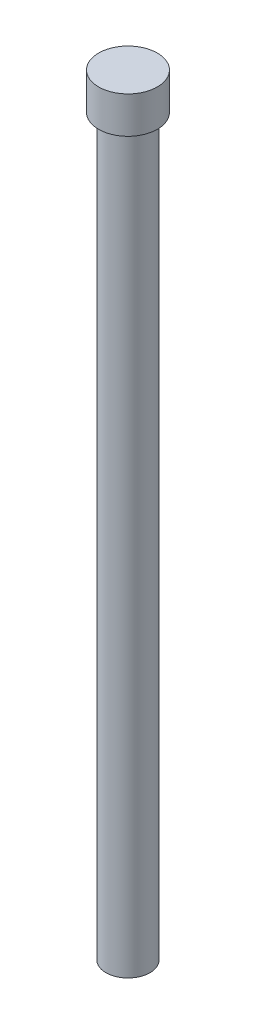
from build123d import *

# Parameters (mm, degrees)
SKETCH1_R           = 0.762
BOSS_EXTRUDE1_DEPTH = 25.4
SKETCH2_R           = 1.016
BOSS_EXTRUDE2_DEPTH = 1.27


with BuildPart() as part:
    # Sketch1 → Boss-Extrude1 (new body)
    with BuildSketch(Plane(origin=(0, 0, 0), x_dir=(1, 0, 0), z_dir=(0, 1, 0))):
        with Locations(Location((0, 0, 0), (0, 0, 270))):
            Circle(SKETCH1_R)
    extrude(amount=BOSS_EXTRUDE1_DEPTH)

    # Sketch2 → Boss-Extrude2 (add)
    with BuildSketch(Plane(origin=(0, 25.4, 0), x_dir=(1, 0, 0), z_dir=(0, 1, 0))):
        with Locations(Location((0, 0, 0), (0, 0, 270))):
            Circle(SKETCH2_R)
    extrude(amount=BOSS_EXTRUDE2_DEPTH)


solid = part.part
